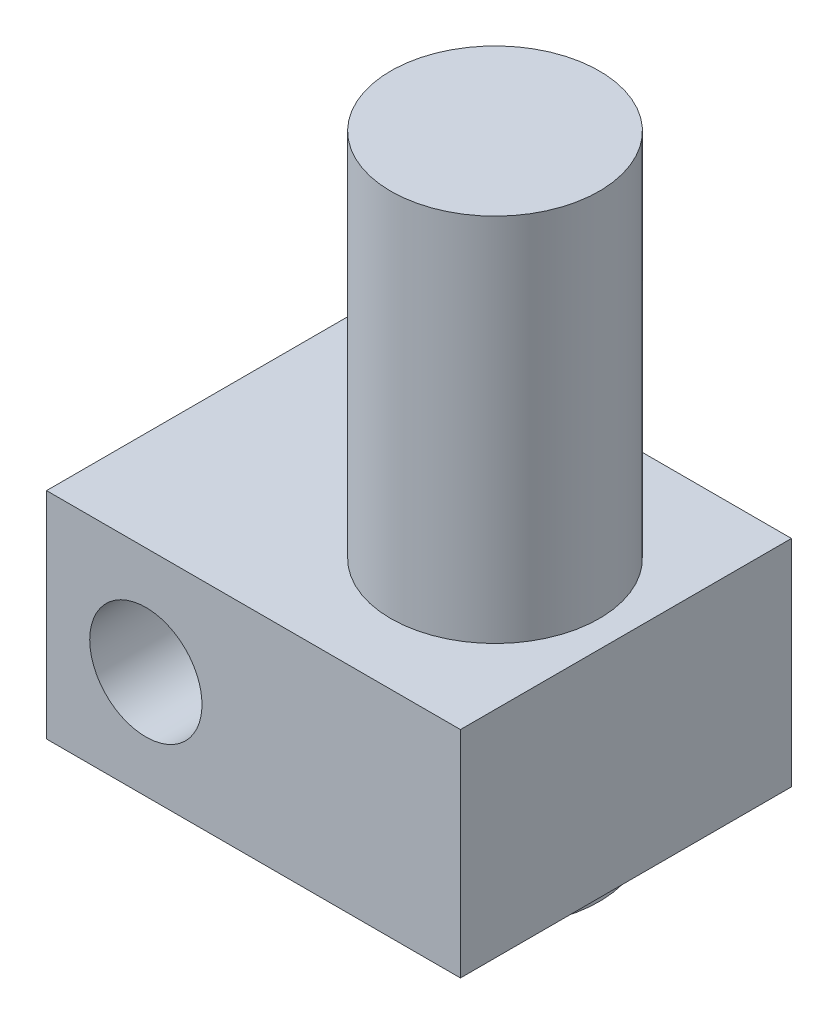
from build123d import *

# Parameters (mm, degrees)
SKETCH1_W                = 15.88
SKETCH1_H                = 12.7
BOSS_EXTRUDE1_DEPTH      = 8.255
BOSS_EXTRUDE2_DEPTH      = 14.2
BOSS_EXTRUDE2_DEPTH_BACK = 11
SKETCH2_R                = 4
CHAMFER1_SIZE            = 3
CHAMFER1_SIZE2           = 1.595128295
SKETCH4_R                = 1
BOSS_EXTRUDE3_DEPTH      = 0.5
SKETCH5_R                = 2.153363707
CUT_EXTRUDE1_DEPTH       = 27.9918622


with BuildPart() as part:
    # Sketch1 → Boss-Extrude1 (new body)
    with BuildSketch(Plane(origin=(0, 0, 0), x_dir=(1, 0, 0), z_dir=(0, 1, 0))):
        Rectangle(SKETCH1_W, SKETCH1_H)
    extrude(amount=BOSS_EXTRUDE1_DEPTH)

    # Sketch2 → Boss-Extrude2 (add, two sides: drawn at the far end of the back side and taken through both)
    with BuildSketch(Plane(origin=(0, 8.255, 0), x_dir=(1, 0, 0), z_dir=(0, 1, 0)).offset(-BOSS_EXTRUDE2_DEPTH_BACK)):
        with Locations(Location((2.917, 0, 0), (0, 0, 270))):
            Circle(SKETCH2_R)
    extrude(amount=BOSS_EXTRUDE2_DEPTH + BOSS_EXTRUDE2_DEPTH_BACK)

    # Chamfer1
    chamfer1_edges = [part.edges().sort_by_distance(p)[0] for p in [
        (2.917, -2.745, -4),
    ]]
    chamfer1_side = [part.faces().sort_by_distance(p)[0] for p in [
        (2.917, -2.745, 0),
    ]]
    chamfer(chamfer1_edges, length=CHAMFER1_SIZE, length2=CHAMFER1_SIZE2, reference=chamfer1_side[0])

    # Sketch4 → Boss-Extrude3 (add)
    with BuildSketch(Plane.XZ.offset(2.745)):
        with Locations(Location((2.917, 0, 0), (0, 0, 90))):
            Circle(SKETCH4_R)
    extrude(amount=BOSS_EXTRUDE3_DEPTH)

    # Sketch5 → Cut-Extrude1 (cut, through all)
    with BuildSketch(Plane(origin=(0, 0, -6.35), x_dir=(-1, 0, 0), z_dir=(0, 0, -1))):
        with Locations((4.13, 4.1275)):
            Circle(SKETCH5_R)
    extrude(amount=-CUT_EXTRUDE1_DEPTH, mode=Mode.SUBTRACT)


solid = part.part
